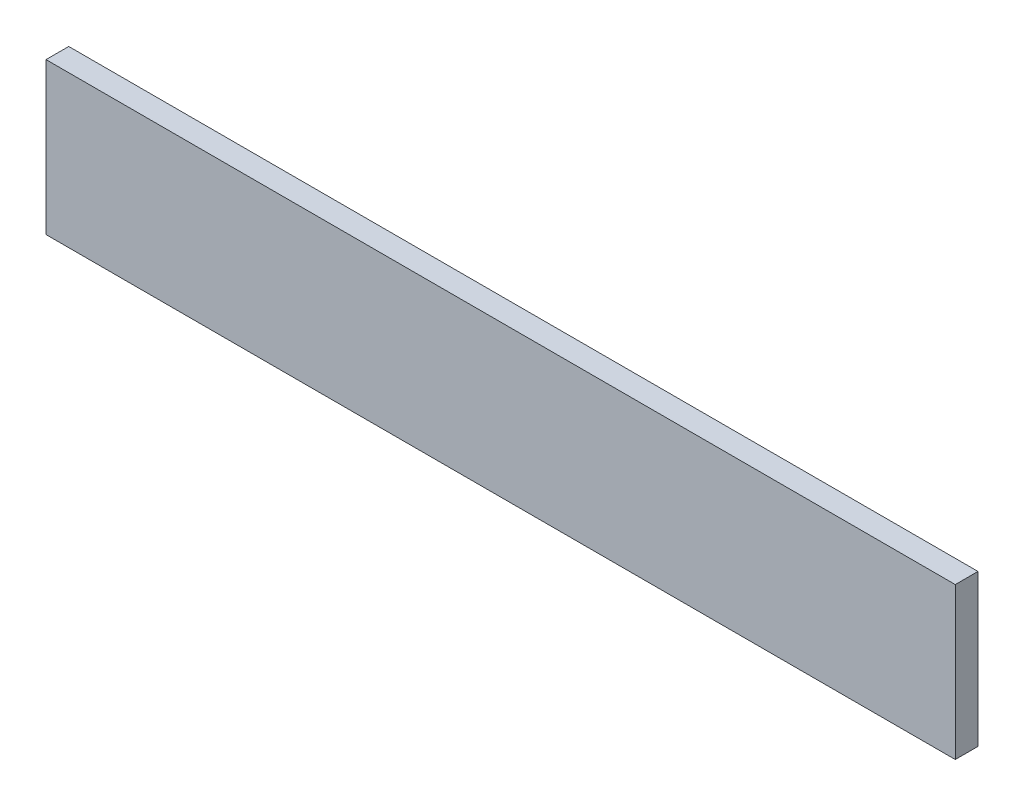
from build123d import *

# Parameters (mm, degrees)
ESQUISSE1_W        = 240
ESQUISSE1_H        = 40
BOSS_EXTRU_1_DEPTH = 6


with BuildPart() as part:
    # Esquisse1 → Boss.-Extru.1 (new body)
    with BuildSketch(Plane.XY):
        with Locations((-120, 20)):
            Rectangle(ESQUISSE1_W, ESQUISSE1_H)
    extrude(amount=BOSS_EXTRU_1_DEPTH)


solid = part.part
